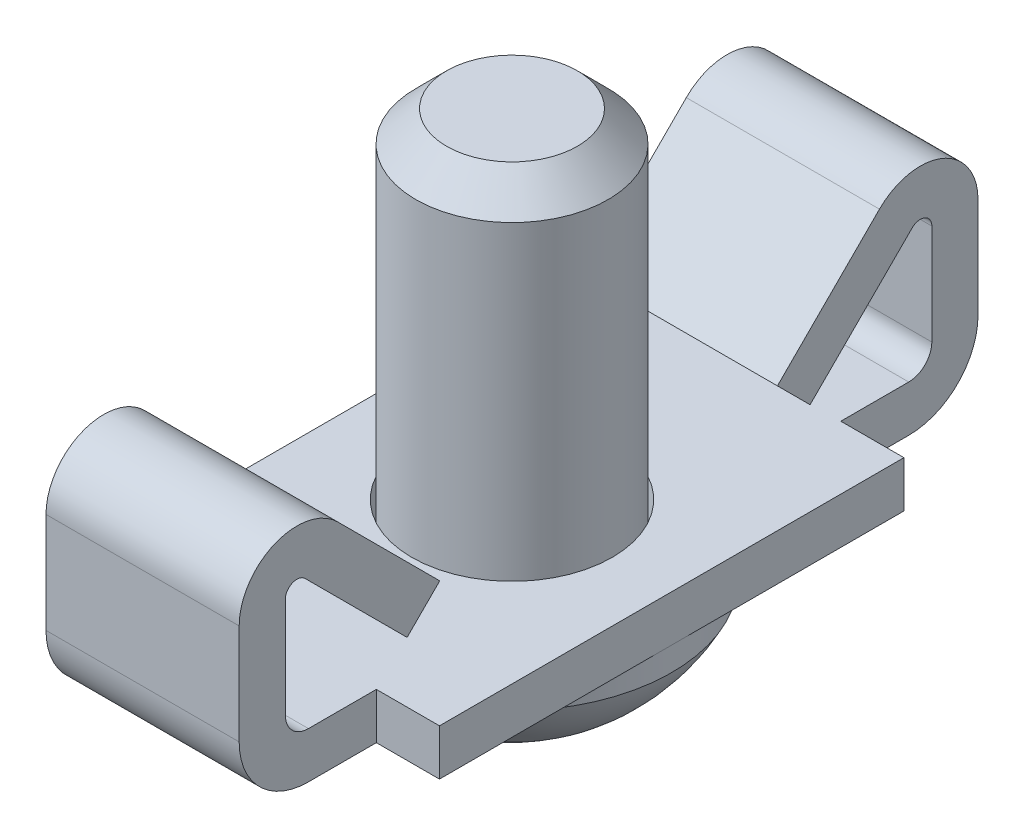
from build123d import *

# Parameters (mm, degrees)
BOSS_EXTRUDE1_DEPTH = 3.1877
SKETCH2_W           = 15.3289
SKETCH2_H           = 1.524
BOSS_EXTRUDE2_DEPTH = 2.0828
SKETCH3_R           = 3.30835
CUT_EXTRUDE1_DEPTH  = 15.567215559
CUT_EXTRUDE2_DEPTH  = 3.175


with BuildPart() as part:
    # Sketch1 → Boss-Extrude1 (new, symmetric)
    with BuildSketch(Plane(origin=(0, 0, 0), x_dir=(0, 0, -1), z_dir=(1, 0, 0))):
        with BuildLine():
            Line((9.906, 0), (-9.906, 0))
            ThreePointArc((-9.906, 0), (-11.522446102, 0.669553898), (-12.192, 2.286))
            Line((-12.192, 2.286), (-12.192, 5.6007))
            ThreePointArc((-12.192, 5.6007), (-11.016011939, 7.360690509), (-8.939961582, 6.947738418))
            Line((-8.939961582, 6.947738418), (-5.572365536, 3.580142373))
            Line((-5.572365536, 3.580142373), (-6.649996271, 2.502511638))
            Line((-6.649996271, 2.502511638), (-10.017592316, 5.870107684))
            ThreePointArc((-10.017592316, 5.870107684), (-10.432802388, 5.952698102), (-10.668, 5.6007))
            Line((-10.668, 5.6007), (-10.668, 2.286))
            ThreePointArc((-10.668, 2.286), (-10.444815367, 1.747184633), (-9.906, 1.524))
            Line((-9.906, 1.524), (9.906, 1.524))
            ThreePointArc((9.906, 1.524), (10.444815367, 1.747184633), (10.668, 2.286))
            Line((10.668, 2.286), (10.668, 5.6007))
            ThreePointArc((10.668, 5.6007), (10.432802388, 5.952698102), (10.017592316, 5.870107684))
            Line((10.017592316, 5.870107684), (6.649996271, 2.502511638))
            Line((6.649996271, 2.502511638), (5.572365536, 3.580142373))
            Line((5.572365536, 3.580142373), (8.939961582, 6.947738418))
            ThreePointArc((8.939961582, 6.947738418), (11.016011939, 7.360690509), (12.192, 5.6007))
            Line((12.192, 5.6007), (12.192, 2.286))
            ThreePointArc((12.192, 2.286), (11.522446102, 0.669553898), (9.906, 0))
        make_face()
    extrude(amount=BOSS_EXTRUDE1_DEPTH, both=True)

    # Sketch2 → Boss-Extrude2 (add)
    with BuildSketch(Plane(origin=(3.1877, 0, 0), x_dir=(0, 0, -1), z_dir=(1, 0, 0))):
        with Locations((0, 0.762)):
            Rectangle(SKETCH2_W, SKETCH2_H)
    boss_extrude2 = extrude(amount=BOSS_EXTRUDE2_DEPTH)

    # Mirror1: Boss-Extrude2 across plane
    add(boss_extrude2.mirror(Plane(origin=(0, 0, 0), x_dir=(0, 0, 1), z_dir=(1, 0, 0))))

    # Sketch3 → Cut-Extrude1 (cut, through all)
    with BuildSketch(Plane(origin=(0, 1.524, 0), x_dir=(1, 0, 0), z_dir=(0, 1, 0))):
        with Locations(Location((0, 0, 0), (0, 0, 270))):
            Circle(SKETCH3_R)
    extrude(amount=-CUT_EXTRUDE1_DEPTH, mode=Mode.SUBTRACT)

    # Sketch4 → Revolve1 (revolve)
    with BuildSketch(Plane(origin=(0, 0, 0), x_dir=(0, 0, -1), z_dir=(1, 0, 0)), mode=Mode.PRIVATE) as revolve1_sk:
        with BuildLine():
            Line((3.175, 0), (5.2705, 0))
            Line((5.2705, 0), (5.2705, -0.7874))
            ThreePointArc((5.2705, -0.7874), (4.374468906, -2.11435755), (3.175, -3.175))
            Line((3.175, -3.175), (0, -3.175))
            Line((0, -3.175), (0, 12.7))
            Line((0, 12.7), (2.159, 12.7))
            Line((2.159, 12.7), (3.175, 11.684))
            Line((3.175, 11.684), (3.175, 0))
        make_face()
    revolve(revolve1_sk.sketch.rotate(Axis((0, 19.260698501, 0), (0, -1, 0)), 180), axis=Axis((0, 19.260698501, 0), (0, -1, 0)))

    # Sketch5 → Cut-Extrude2 (cut)
    with BuildSketch(Plane.XZ.offset(3.175)):
        Polygon((0, 2.287692707), (-1.9812, 1.143846353), (-1.9812, -1.143846353), (0, -2.287692707), (1.9812, -1.143846353), (1.9812, 1.143846353), align=None)
    extrude(amount=-CUT_EXTRUDE2_DEPTH, mode=Mode.SUBTRACT)


solid = part.part
